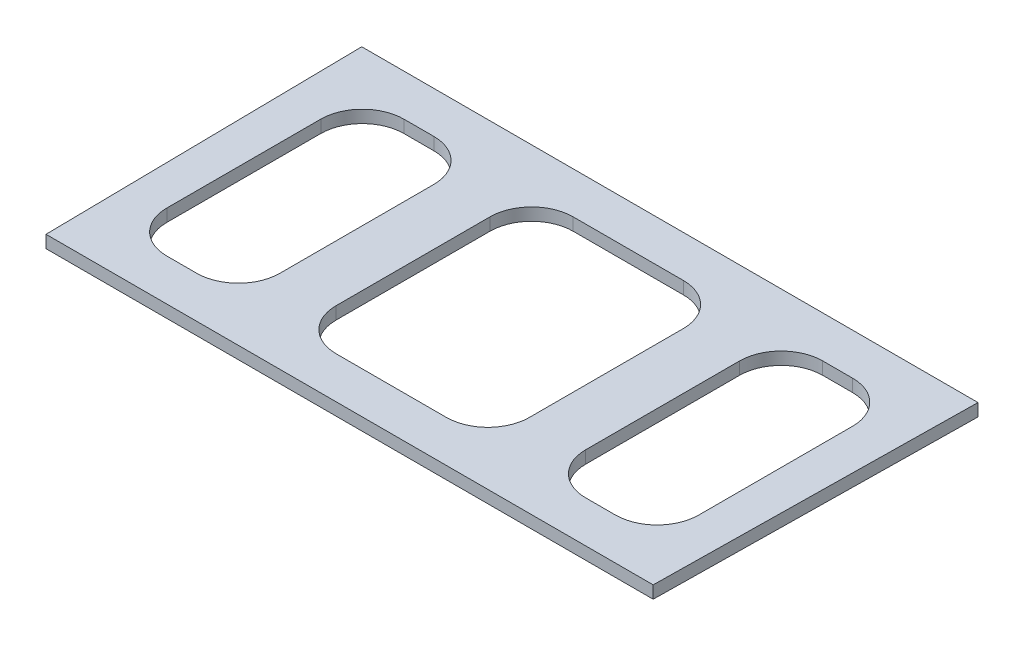
from build123d import *

# Parameters (mm, degrees)
BOSS_EXTRUDE1_DEPTH = 3
CUT_EXTRUDE1_DEPTH  = 10


with BuildPart() as part:
    # Sketch1 → Boss-Extrude1 (new body)
    with BuildSketch(Plane(origin=(0, 0, 0), x_dir=(1, 0, 0), z_dir=(0, 1, 0))):
        Polygon((-72.98636562, 0), (72.98636562, 0), (74.075, 77), (-74.075, 77), align=None)
    extrude(amount=BOSS_EXTRUDE1_DEPTH)

    # Sketch2 → Cut-Extrude1 (cut)
    with BuildSketch(Plane(origin=(0, 3, 0), x_dir=(1, 0, 0), z_dir=(0, 1, 0))):
        with BuildLine():
            Line((-46.75, 67), (-53.932619531, 67))
            ThreePointArc((-53.932619531, 67), (-61.003687343, 64.071067812), (-63.932619531, 57))
            Line((-63.932619531, 57), (-63.932619531, 20))
            ThreePointArc((-63.932619531, 20), (-61.003687343, 12.928932188), (-53.932619531, 10))
            Line((-53.932619531, 10), (-46.75, 10))
            ThreePointArc((-46.75, 10), (-39.678932188, 12.928932188), (-36.75, 20))
            Line((-36.75, 20), (-36.75, 57))
            ThreePointArc((-36.75, 57), (-39.678932188, 64.071067812), (-46.75, 67))
        make_face()
        with BuildLine():
            Line((-13.25, 67), (0, 67))
            Line((0, 67), (0, 10))
            Line((0, 10), (-13.25, 10))
            ThreePointArc((-13.25, 10), (-20.321067812, 12.928932188), (-23.25, 20))
            Line((-23.25, 20), (-23.25, 57))
            ThreePointArc((-23.25, 57), (-20.321067812, 64.071067812), (-13.25, 67))
        make_face()
    cut_extrude1 = extrude(amount=-CUT_EXTRUDE1_DEPTH, mode=Mode.SUBTRACT)

    # Mirror1: Cut-Extrude1 across plane
    add(cut_extrude1.mirror(Plane(origin=(0, 0, 0), x_dir=(0, 0, 1), z_dir=(1, 0, 0))), mode=Mode.SUBTRACT)


solid = part.part
